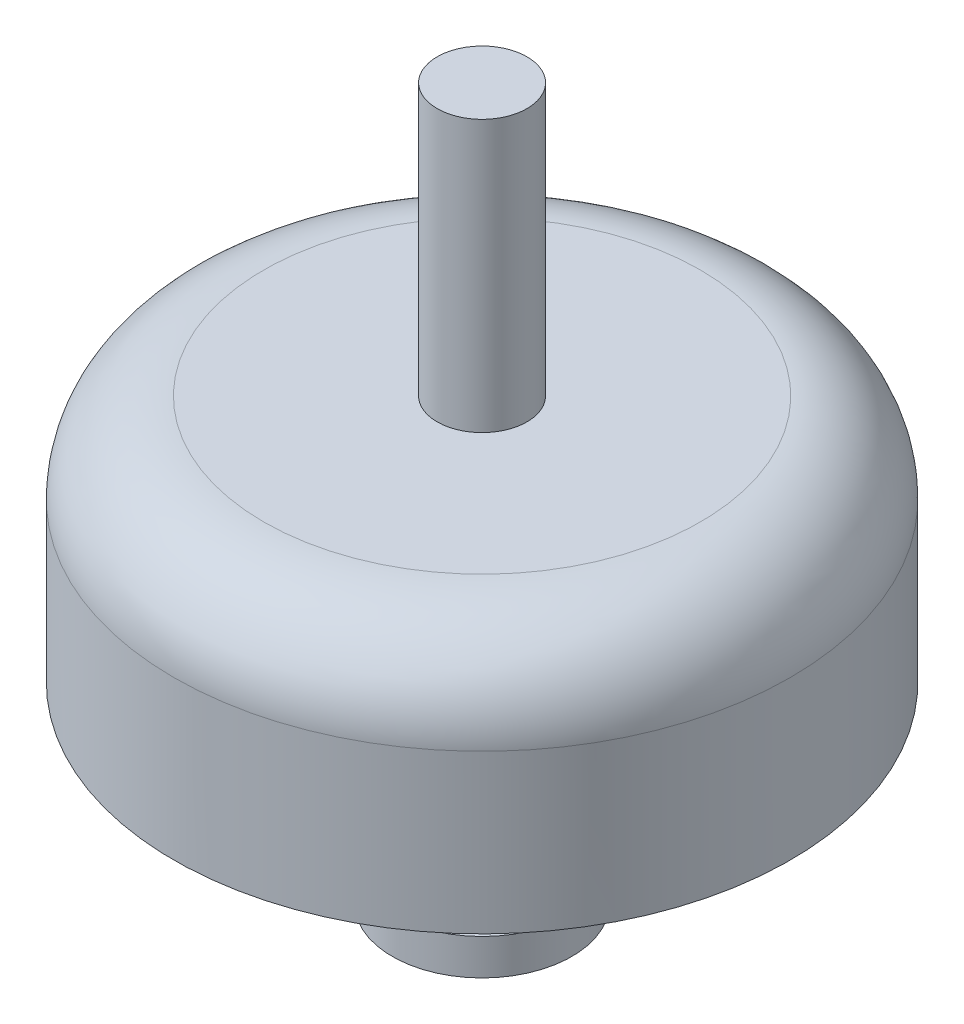
from build123d import *

# Parameters (mm, degrees)
SKETCH_1_R      = 1.5
EXTRUDE_1_DEPTH = 2
SKETCH_2_R      = 7
EXTRUDE_2_DEPTH = 2
SKETCH_3_R      = 17.15
EXTRUDE_3_DEPTH = 13.8
FILLET_1_R      = 5
SKETCH_4_R      = 2.5
EXTRUDE_4_DEPTH = 15.1


with BuildPart() as part:
    # 草图1 → 凸台-拉伸1 (new body)
    with BuildSketch(Plane(origin=(0, 0, 0), x_dir=(1, 0, 0), z_dir=(0, 1, 0))):
        with BuildLine():
            ThreePointArc((-2.706611278, 9.702921591), (-10.253048327, 10.253048327), (-9.702921591, 2.706611278))
            ThreePointArc((-9.702921591, 2.706611278), (-8.343447309, 0), (-9.702921591, -2.706611278))
            ThreePointArc((-9.702921591, -2.706611278), (-10.253048327, -10.253048327), (-2.706611278, -9.702921591))
            ThreePointArc((-2.706611278, -9.702921591), (0, -8.343447309), (2.706611278, -9.702921591))
            ThreePointArc((2.706611278, -9.702921591), (10.253048327, -10.253048327), (9.702921591, -2.706611278))
            ThreePointArc((9.702921591, -2.706611278), (8.343447309, 0), (9.702921591, 2.706611278))
            ThreePointArc((9.702921591, 2.706611278), (10.253048327, 10.253048327), (2.706611278, 9.702921591))
            ThreePointArc((2.706611278, 9.702921591), (0, 8.343447309), (-2.706611278, 9.702921591))
        make_face()
        with Locations(Location((-6.717514421, 6.717514421, 0), (0, 0, 270))):
            Circle(SKETCH_1_R, mode=Mode.SUBTRACT)
        with Locations(Location((6.717514421, 6.717514421, 0), (0, 0, 270))):
            Circle(SKETCH_1_R, mode=Mode.SUBTRACT)
        with Locations(Location((6.717514421, -6.717514421, 0), (0, 0, 270))):
            Circle(SKETCH_1_R, mode=Mode.SUBTRACT)
        with Locations(Location((-6.717514421, -6.717514421, 0), (0, 0, 270))):
            Circle(SKETCH_1_R, mode=Mode.SUBTRACT)
    extrude(amount=EXTRUDE_1_DEPTH)

    # 草图2 → 凸台-拉伸2 (add)
    with BuildSketch(Plane(origin=(0, 2, 0), x_dir=(1, 0, 0), z_dir=(0, 1, 0))):
        with Locations(Location((0, 0, 0), (0, 0, 270))):
            Circle(SKETCH_2_R)
    extrude(amount=EXTRUDE_2_DEPTH)

    # 草图3 → 凸台-拉伸3 (add)
    with BuildSketch(Plane(origin=(0, 4, 0), x_dir=(1, 0, 0), z_dir=(0, 1, 0))):
        with Locations(Location((0, 0, 0), (0, 0, 90))):
            Circle(SKETCH_3_R)
    extrude(amount=EXTRUDE_3_DEPTH)

    # 圆角1
    fillet_1_edges = [part.edges().sort_by_distance(p)[0] for p in [
        (0, 17.8, 17.15),
    ]]
    fillet(fillet_1_edges, radius=FILLET_1_R)

    # 草图4 → 凸台-拉伸4 (add)
    with BuildSketch(Plane(origin=(0, 17.8, 0), x_dir=(1, 0, 0), z_dir=(0, 1, 0))):
        with Locations(Location((0, 0, 0), (0, 0, 270))):
            Circle(SKETCH_4_R)
    extrude(amount=EXTRUDE_4_DEPTH)


solid = part.part
